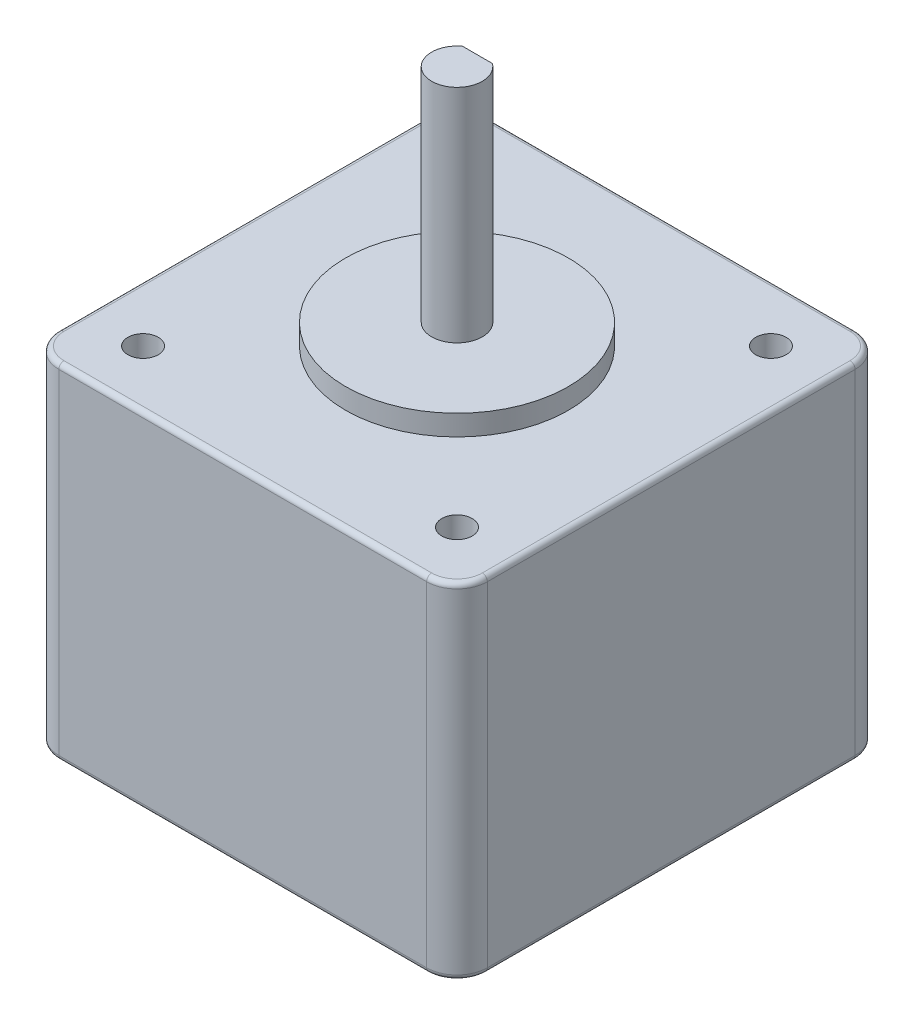
from build123d import *

# Parameters (mm, degrees)
SKETCH2_W           = 42.3
SKETCH2_H           = 42.3
SKETCH2_R           = 1.5
BOSS_EXTRUDE1_DEPTH = 34
SKETCH3_R           = 11
BOSS_EXTRUDE2_DEPTH = 2.03
SKETCH4_R           = 2.5
BOSS_EXTRUDE3_DEPTH = 21.85
CUT_EXTRUDE1_START  = -14.86
CUT_EXTRUDE1_DEPTH  = 14.86
FILLET1_R           = 3
FILLET2_R           = 0.5


with BuildPart() as part:
    # Sketch2 → Boss-Extrude1 (new body)
    with BuildSketch(Plane(origin=(0, 0, 0), x_dir=(1, 0, 0), z_dir=(0, 1, 0))):
        with Locations((21.15, 21.15)):
            Rectangle(SKETCH2_W, SKETCH2_H)
        with Locations(Location((5.655, 36.645, 0), (0, 0, 270))):
            Circle(SKETCH2_R, mode=Mode.SUBTRACT)
        with Locations(Location((36.645, 36.645, 0), (0, 0, 270))):
            Circle(SKETCH2_R, mode=Mode.SUBTRACT)
        with Locations(Location((36.645, 5.655, 0), (0, 0, 270))):
            Circle(SKETCH2_R, mode=Mode.SUBTRACT)
        with Locations(Location((5.655, 5.655, 0), (0, 0, 270))):
            Circle(SKETCH2_R, mode=Mode.SUBTRACT)
    extrude(amount=BOSS_EXTRUDE1_DEPTH)

    # Sketch3 → Boss-Extrude2 (add)
    with BuildSketch(Plane(origin=(0, 34, 0), x_dir=(1, 0, 0), z_dir=(0, 1, 0))):
        with Locations(Location((21.15, 21.15, 0), (0, 0, 270))):
            Circle(SKETCH3_R)
    extrude(amount=BOSS_EXTRUDE2_DEPTH)

    # Sketch4 → Boss-Extrude3 (add)
    with BuildSketch(Plane(origin=(0, 36.03, 0), x_dir=(1, 0, 0), z_dir=(0, 1, 0))):
        with Locations(Location((21.15, 21.15, 0), (0, 0, 270))):
            Circle(SKETCH4_R)
    extrude(amount=BOSS_EXTRUDE3_DEPTH)

    # Sketch5 → Cut-Extrude1 (cut)
    with BuildSketch(Plane(origin=(0, 57.88, 0), x_dir=(1, 0, 0), z_dir=(0, 1, 0)).offset(CUT_EXTRUDE1_START)):
        with BuildLine():
            Line((19.677043789, 23.17), (22.622956211, 23.17))
            ThreePointArc((22.622956211, 23.17), (21.15, 23.65), (19.677043789, 23.17))
        make_face()
    extrude(amount=CUT_EXTRUDE1_DEPTH, mode=Mode.SUBTRACT)

    # Fillet1
    fillet1_edges = [part.edges().sort_by_distance(p)[0] for p in [
        (0, 17, -42.3),
        (42.3, 17, -42.3),
        (42.3, 17, 0),
        (0, 17, 0),
    ]]
    fillet(fillet1_edges, radius=FILLET1_R)

    # Fillet2
    fillet2_edges = [part.edges().sort_by_distance(p)[0] for p in [
        (0, 0, -21.15),
        (0, 34, -21.15),
        (21.15, 0, -42.3),
        (42.3, 0, -21.15),
        (21.15, 0, 0),
        (0.878679656, 0, -0.878679656),
        (41.421320344, 0, -0.878679656),
        (41.421320344, 0, -41.421320344),
        (0.878679656, 0, -41.421320344),
        (21.15, 34, -42.3),
        (21.15, 34, 0),
        (42.3, 34, -21.15),
        (0.878679656, 34, -0.878679656),
        (41.421320344, 34, -0.878679656),
        (41.421320344, 34, -41.421320344),
        (0.878679656, 34, -41.421320344),
    ]]
    fillet(fillet2_edges, radius=FILLET2_R)


solid = part.part
